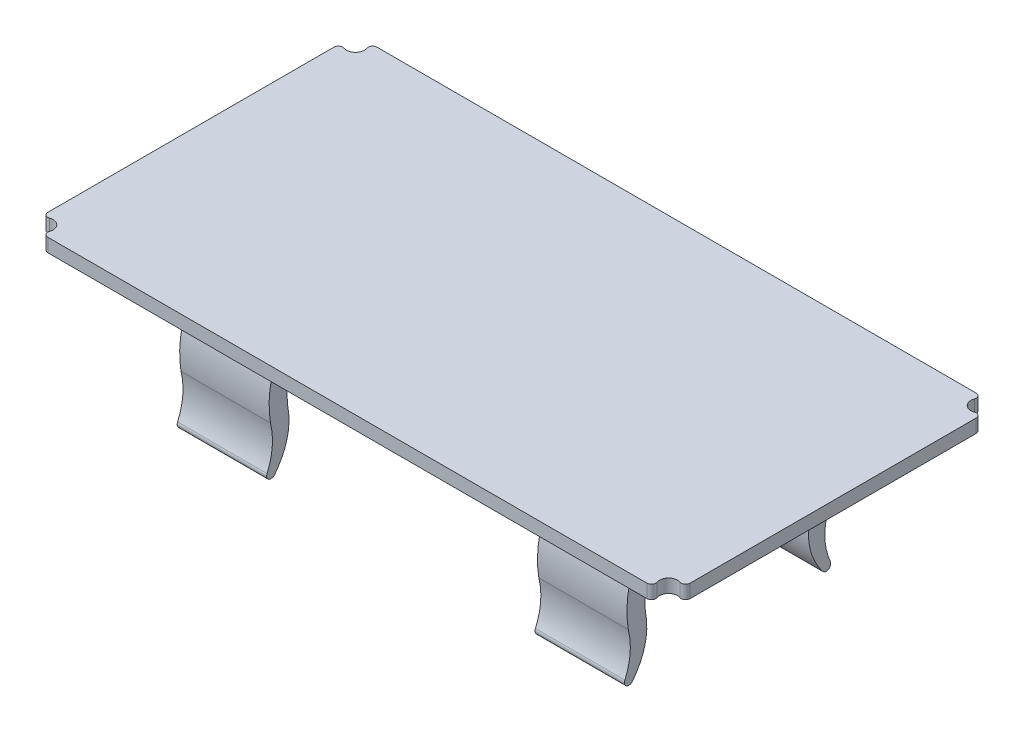
from build123d import *

# Parameters (mm, degrees)
BOSS_EXTRUDE1_DEPTH = 1.5
BOSS_EXTRUDE2_START = -10
BOSS_EXTRUDE2_DEPTH = 10
BOSS_EXTRUDE3_START = -50
BOSS_EXTRUDE3_DEPTH = 10
FILLET1_R           = 2


with BuildPart() as part:
    # Sketch1 → Boss-Extrude1 (new body)
    with BuildSketch(Plane(origin=(0, 0, 0), x_dir=(1, 0, 0), z_dir=(0, 1, 0))):
        with BuildLine():
            Line((2.414213562, 0), (69.385786438, 0))
            ThreePointArc((69.385786438, 0), (69.794034728, 0.211324865), (69.857190958, 0.666666667))
            ThreePointArc((69.857190958, 0.666666667), (70.092893219, 1.707106781), (71.133333333, 1.942809042))
            ThreePointArc((71.133333333, 1.942809042), (71.588675135, 2.005965272), (71.8, 2.414213562))
            Line((71.8, 2.414213562), (71.8, 34.385786438))
            ThreePointArc((71.8, 34.385786438), (71.588675135, 34.794034728), (71.133333333, 34.857190958))
            ThreePointArc((71.133333333, 34.857190958), (70.092893219, 35.092893219), (69.857190958, 36.133333333))
            ThreePointArc((69.857190958, 36.133333333), (69.794034728, 36.588675135), (69.385786438, 36.8))
            Line((69.385786438, 36.8), (2.414213562, 36.8))
            ThreePointArc((2.414213562, 36.8), (2.005965272, 36.588675135), (1.942809042, 36.133333333))
            ThreePointArc((1.942809042, 36.133333333), (1.707106781, 35.092893219), (0.666666667, 34.857190958))
            ThreePointArc((0.666666667, 34.857190958), (0.211324865, 34.794034728), (0, 34.385786438))
            Line((0, 34.385786438), (0, 2.414213562))
            ThreePointArc((0, 2.414213562), (0.211324865, 2.005965272), (0.666666667, 1.942809042))
            ThreePointArc((0.666666667, 1.942809042), (1.707106781, 1.707106781), (1.942809042, 0.666666667))
            ThreePointArc((1.942809042, 0.666666667), (2.005965272, 0.211324865), (2.414213562, 0))
        make_face()
    extrude(amount=BOSS_EXTRUDE1_DEPTH)

    # Sketch3 → Boss-Extrude2 (add)
    with BuildSketch(Plane.ZY.offset(BOSS_EXTRUDE2_START)):
        with BuildLine():
            Line((-12.374014603, 0), (-24.425985397, 0))
            ThreePointArc((-24.425985397, 0), (-28.666594565, -4.90005043), (-29.500762028, -11.326357689))
            add(Edge.make_bspline(
                [(-29.500762028, -11.326357689), (-28.897266876, -13.751803061), (-29.879831091, -16.043728976)],
                knots=[0, 0, 0, 1, 1, 1], degree=2))
            ThreePointArc((-29.879831091, -16.043728976), (-29.693870441, -16.6908382), (-29.032229169, -16.566088301))
            add(Edge.make_bspline(
                [(-27.599358013, -10.46659824), (-26.907734986, -13.817809078), (-29.032229169, -16.566088301)],
                knots=[0, 0, 0, 1, 1, 1], degree=2))
            ThreePointArc((-27.599358013, -10.46659824), (-18.4, -0.25), (-9.200641987, -10.46659824))
            add(Edge.make_bspline(
                [(-9.200641987, -10.46659824), (-9.892265014, -13.817809078), (-7.767770831, -16.566088301)],
                knots=[0, 0, 0, 1, 1, 1], degree=2))
            ThreePointArc((-7.767770831, -16.566088301), (-7.106129559, -16.6908382), (-6.920168909, -16.043728976))
            add(Edge.make_bspline(
                [(-7.299237972, -11.326357689), (-7.902733124, -13.751803061), (-6.920168909, -16.043728976)],
                knots=[0, 0, 0, 1, 1, 1], degree=2))
            ThreePointArc((-7.299237972, -11.326357689), (-8.133405435, -4.90005043), (-12.374014603, 0))
        make_face()
    extrude(amount=-BOSS_EXTRUDE2_DEPTH)

    # Sketch3<3> → Boss-Extrude3 (add)
    with BuildSketch(Plane.ZY.offset(BOSS_EXTRUDE3_START)):
        with BuildLine():
            Line((-24.425985397, 0), (-12.374014603, 0))
            ThreePointArc((-12.374014603, 0), (-8.133405435, -4.90005043), (-7.299237972, -11.326357689))
            add(Edge.make_bspline(
                [(-7.299237972, -11.326357689), (-7.902733124, -13.751803061), (-6.920168909, -16.043728976)],
                knots=[0, 0, 0, 1, 1, 1], degree=2))
            ThreePointArc((-6.920168909, -16.043728976), (-7.106129559, -16.6908382), (-7.767770831, -16.566088301))
            add(Edge.make_bspline(
                [(-9.200641987, -10.46659824), (-9.892265014, -13.817809078), (-7.767770831, -16.566088301)],
                knots=[0, 0, 0, 1, 1, 1], degree=2))
            ThreePointArc((-9.200641987, -10.46659824), (-18.4, -0.25), (-27.599358013, -10.46659824))
            add(Edge.make_bspline(
                [(-27.599358013, -10.46659824), (-26.907734986, -13.817809078), (-29.032229169, -16.566088301)],
                knots=[0, 0, 0, 1, 1, 1], degree=2))
            ThreePointArc((-29.032229169, -16.566088301), (-29.693870441, -16.6908382), (-29.879831091, -16.043728976))
            add(Edge.make_bspline(
                [(-29.500762028, -11.326357689), (-28.897266876, -13.751803061), (-29.879831091, -16.043728976)],
                knots=[0, 0, 0, 1, 1, 1], degree=2))
            ThreePointArc((-29.500762028, -11.326357689), (-28.666594565, -4.90005043), (-24.425985397, 0))
        make_face()
    extrude(amount=-BOSS_EXTRUDE3_DEPTH)

    # Fillet1
    fillet1_edges = [part.edges().sort_by_distance(p)[0] for p in [
        (55, 0, -24.425985397),
        (15, 0, -24.425985397),
        (55, 0, -12.374014603),
        (15, 0, -12.374014603),
    ]]
    fillet(fillet1_edges, radius=FILLET1_R)


solid = part.part
